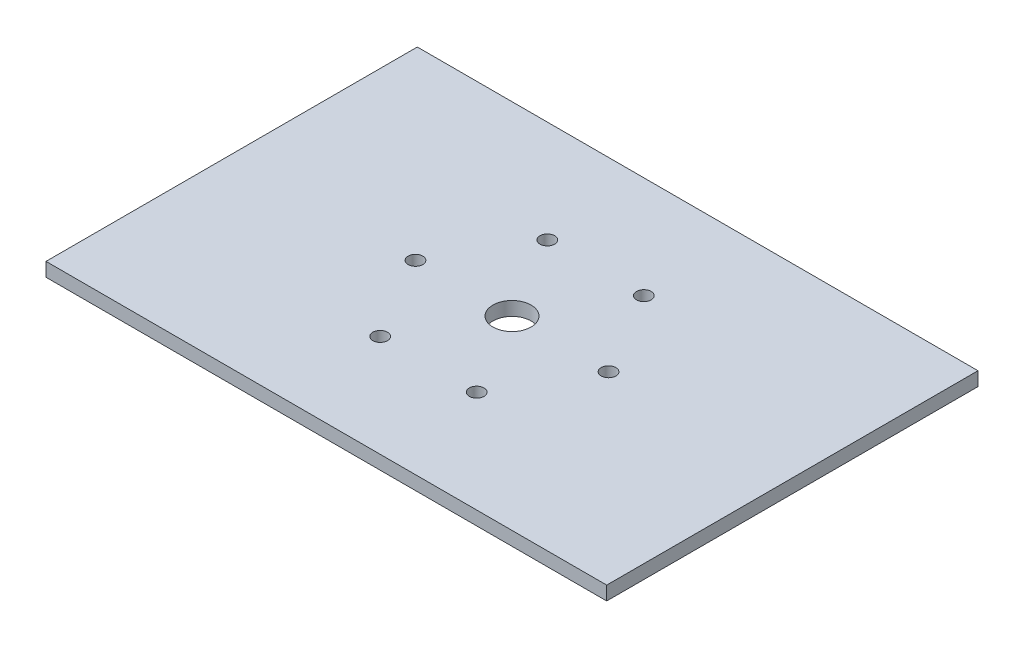
from build123d import *

# Parameters (mm, degrees)
SKETCH1_W           = 122
SKETCH1_H           = 80.79
SKETCH1_R           = 1.6
SKETCH1_R_2         = 4.15
BOSS_EXTRUDE1_DEPTH = 3


with BuildPart() as part:
    # Sketch1 → Boss-Extrude1 (new body)
    with BuildSketch(Plane(origin=(0, 0, 0), x_dir=(1, 0, 0), z_dir=(0, 1, 0))):
        with Locations((61, 40.395)):
            Rectangle(SKETCH1_W, SKETCH1_H)
        with Locations(Location((40, 40.395, 0), (0, 0, 270))):
            Circle(SKETCH1_R, mode=Mode.SUBTRACT)
        with Locations(Location((50.5, 58.581533479, 0), (0, 0, 270))):
            Circle(SKETCH1_R, mode=Mode.SUBTRACT)
        with Locations(Location((71.5, 58.581533479, 0), (0, 0, 270))):
            Circle(SKETCH1_R, mode=Mode.SUBTRACT)
        with Locations(Location((82, 40.395, 0), (0, 0, 270))):
            Circle(SKETCH1_R, mode=Mode.SUBTRACT)
        with Locations(Location((61, 40.395, 0), (0, 0, 270))):
            Circle(SKETCH1_R_2, mode=Mode.SUBTRACT)
        with Locations(Location((71.5, 22.208466521, 0), (0, 0, 270))):
            Circle(SKETCH1_R, mode=Mode.SUBTRACT)
        with Locations(Location((50.5, 22.208466521, 0), (0, 0, 270))):
            Circle(SKETCH1_R, mode=Mode.SUBTRACT)
    extrude(amount=BOSS_EXTRUDE1_DEPTH)


solid = part.part
